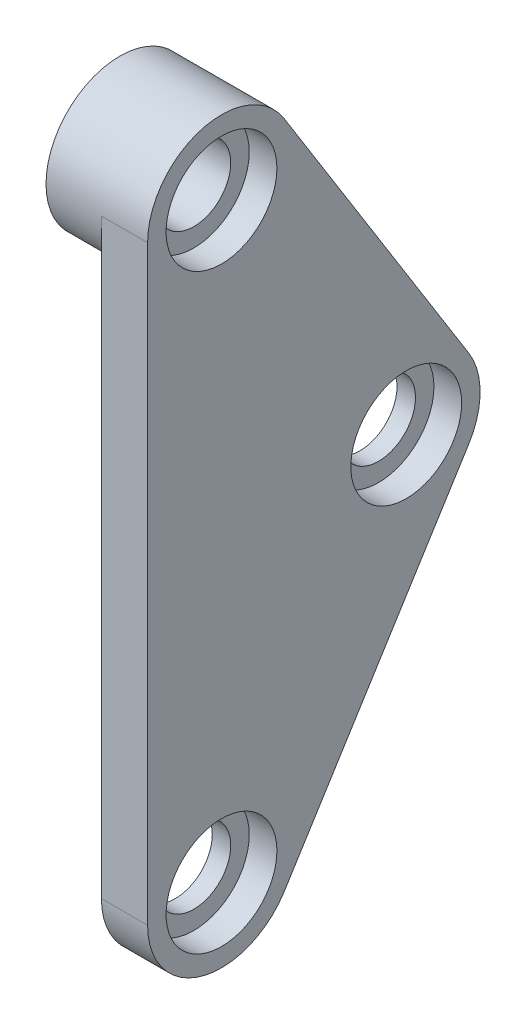
from build123d import *

# Parameters (mm, degrees)
EXTRUDE_1_DEPTH          = 2.5
EXTRUDE_START            = -3
SKETCH_1_4_R             = 4
EXTRUDE_2_DEPTH          = 3
CUT_EXTRUDE_1_DEPTH      = 44.965895874
CUT_EXTRUDE_1_DEPTH_BACK = 44.965895874
SKETCH_1_3_R             = 2
CUT_EXTRUDE_START        = -1.5
SKETCH_2_R               = 3
SKETCH_2_R_2             = 2
CUT_EXTRUDE_2_DEPTH      = 1.5


with BuildPart() as part:
    # 草图1 → 凸台-拉伸1 (new body)
    with BuildSketch(Plane(origin=(0, 0, 0), x_dir=(0, 0, -1), z_dir=(1, 0, 0))):
        with BuildLine():
            Line((17.391993216, -17.88000424), (7.391993216, -1.88000424))
            ThreePointArc((7.391993216, -1.88000424), (2.897269948, -0.155005015), (0, -4))
            Line((0, -4), (0, -36))
            ThreePointArc((0, -36), (2.897269948, -39.844994985), (7.391993216, -38.11999576))
            Line((7.391993216, -38.11999576), (17.391993216, -22.11999576))
            ThreePointArc((17.391993216, -22.11999576), (18, -20), (17.391993216, -17.88000424))
        make_face()
    extrude(amount=EXTRUDE_1_DEPTH)

    # 草图1<4> → 凸台-拉伸2 (add)
    with BuildSketch(Plane(origin=(0, 0, 0), x_dir=(0, 0, -1), z_dir=(1, 0, 0)).offset(EXTRUDE_START)):
        with Locations((4, -4)):
            Circle(SKETCH_1_4_R)
    extrude(amount=EXTRUDE_2_DEPTH)

    # 草图1<3> → 切除-拉伸1 (cut, two sides: drawn at the far end of the back side and taken through both)
    with BuildSketch(Plane(origin=(0, 0, 0), x_dir=(0, 0, -1), z_dir=(1, 0, 0)).offset(-CUT_EXTRUDE_1_DEPTH_BACK)):
        with Locations((4, -4)):
            Circle(SKETCH_1_3_R)
        with Locations((14, -20)):
            Circle(SKETCH_1_3_R)
        with Locations((4, -36)):
            Circle(SKETCH_1_3_R)
    extrude(amount=CUT_EXTRUDE_1_DEPTH + CUT_EXTRUDE_1_DEPTH_BACK, mode=Mode.SUBTRACT)

    # 草图2 → 切除-拉伸2 (cut)
    # profile 1 of 3: a face of its own
    with BuildSketch(Plane(origin=(2.5, 0, 0), x_dir=(0, 0, -1), z_dir=(1, 0, 0)).offset(CUT_EXTRUDE_START)):
        with Locations((4, -4)):
            Circle(SKETCH_2_R)
        with Locations((4, -4)):
            Circle(SKETCH_2_R_2, mode=Mode.SUBTRACT)
    # profile 2 of 3: a face of its own
    with BuildSketch(Plane(origin=(2.5, 0, 0), x_dir=(0, 0, -1), z_dir=(1, 0, 0)).offset(CUT_EXTRUDE_START)):
        with Locations((14, -20)):
            Circle(SKETCH_2_R)
    # profile 3 of 3: a face of its own
    with BuildSketch(Plane(origin=(2.5, 0, 0), x_dir=(0, 0, -1), z_dir=(1, 0, 0)).offset(CUT_EXTRUDE_START)):
        with Locations((4, -36)):
            Circle(SKETCH_2_R)
        with Locations((4, -36)):
            Circle(SKETCH_2_R_2, mode=Mode.SUBTRACT)
    extrude(amount=CUT_EXTRUDE_2_DEPTH, mode=Mode.SUBTRACT)


solid = part.part
